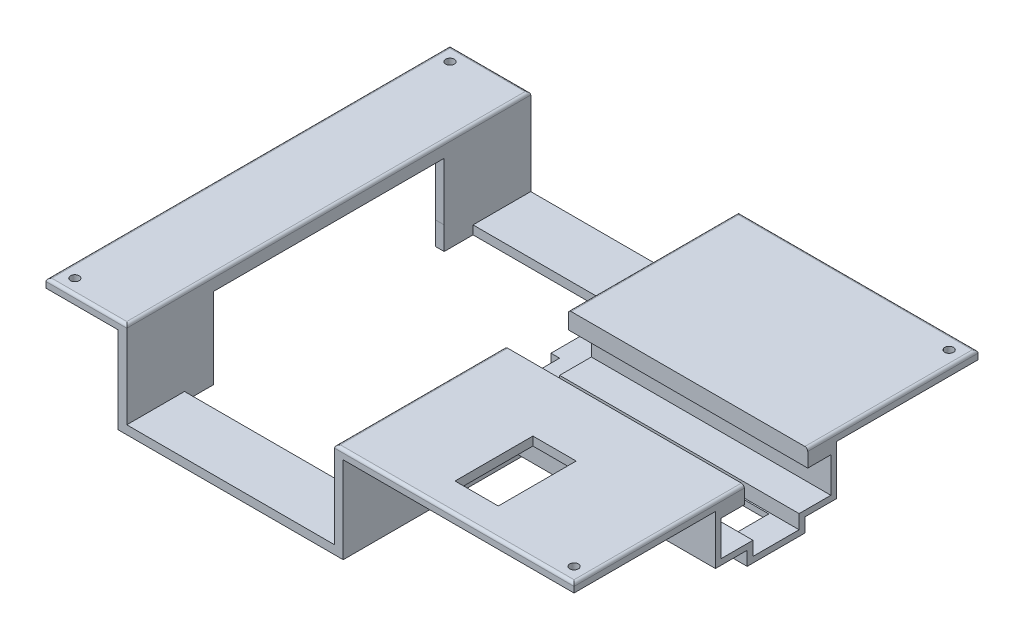
from build123d import *

# Parameters (mm, degrees)
SKETCH1_W               = 183
SKETCH1_H               = 140
BOSS_EXTRUDE1_DEPTH     = 3
SKETCH2_W               = 78
SKETCH2_H               = 140
BOSS_EXTRUDE2_DEPTH     = 30
SKETCH3_W               = 72
SKETCH3_H               = 30
CUT_EXTRUDE1_DEPTH      = 140
SKETCH5_W               = 80
SKETCH5_H               = 70
BOSS_EXTRUDE3_DEPTH     = 25
CUT_EXTRUDE2_DEPTH      = 199.214530244
CUT_EXTRUDE2_DEPTH_BACK = 85
SKETCH7_W               = 20
SKETCH7_H               = 30
CUT_EXTRUDE3_DEPTH      = 85
SKETCH8_W               = 60
SKETCH8_H               = 20
CUT_EXTRUDE4_DEPTH      = 85
SKETCH9_W               = 50
SKETCH9_H               = 15
CUT_EXTRUDE5_DEPTH      = 10
SKETCH11_W              = 20
SKETCH11_H              = 20
CUT_EXTRUDE6_DEPTH      = 10
SKETCH12_W              = 20
SKETCH12_H              = 20
CUT_EXTRUDE7_DEPTH      = 10
SKETCH15_W              = 42
SKETCH15_H              = 100
CUT_EXTRUDE8_DEPTH      = 10
SKETCH16_W              = 13.088467217
SKETCH16_H              = 23
BOSS_EXTRUDE4_DEPTH     = 83
SKETCH17_W              = 13.301151585
SKETCH17_H              = 23.738473688
BOSS_EXTRUDE5_DEPTH     = 83
SKETCH18_W              = 83
SKETCH18_H              = 6
BOSS_EXTRUDE6_DEPTH     = 8
SKETCH19_W              = 83
SKETCH19_H              = 6
BOSS_EXTRUDE7_DEPTH     = 8
SKETCH20_W              = 14
SKETCH20_H              = 25
CUT_EXTRUDE9_DEPTH      = 80
SKETCH21_W              = 14
SKETCH21_H              = 25
CUT_EXTRUDE10_DEPTH     = 80
SKETCH22_W              = 42
SKETCH22_H              = 3
CUT_EXTRUDE11_DEPTH     = 80
SKETCH23_W              = 10
SKETCH23_H              = 100
CUT_EXTRUDE12_DEPTH     = 3
SKETCH24_W              = 80.000727439
SKETCH24_H              = 8
CUT_EXTRUDE13_DEPTH     = 3
SKETCH25_W              = 11
SKETCH25_H              = 4.85
BOSS_EXTRUDE9_DEPTH     = 83
SKETCH26_W              = 11
SKETCH26_H              = 4.85
BOSS_EXTRUDE10_DEPTH    = 83
SKETCH27_W              = 11
SKETCH27_H              = 4.85
CUT_EXTRUDE14_DEPTH     = 80
SKETCH28_W              = 11
SKETCH28_H              = 4.85
CUT_EXTRUDE15_DEPTH     = 80
SKETCH29_W              = 15
SKETCH29_H              = 27
CUT_EXTRUDE16_DEPTH     = 12
FILLET2_R               = 1
SKETCH30_R              = 1.5
CUT_EXTRUDE17_DEPTH     = 3
SKETCH31_R              = 1.5
CUT_EXTRUDE18_DEPTH     = 3
SKETCH32_R              = 1.5
CUT_EXTRUDE19_DEPTH     = 3
SKETCH33_R              = 1.5
CUT_EXTRUDE20_DEPTH     = 3


with BuildPart() as part:
    # Sketch1 → Boss-Extrude1 (new body)
    with BuildSketch(Plane(origin=(0, 0, 0), x_dir=(1, 0, 0), z_dir=(0, 1, 0))):
        Rectangle(SKETCH1_W, SKETCH1_H)
    extrude(amount=BOSS_EXTRUDE1_DEPTH)

    # Sketch2 → Boss-Extrude2 (add)
    with BuildSketch(Plane.XZ):
        with Locations((-27.5, 0)):
            Rectangle(SKETCH2_W, SKETCH2_H)
    extrude(amount=BOSS_EXTRUDE2_DEPTH)

    # Sketch3 → Cut-Extrude1 (cut)
    with BuildSketch(Plane.XY.offset(70)):
        with Locations((-27.5, -12)):
            Rectangle(SKETCH3_W, SKETCH3_H)
    extrude(amount=-CUT_EXTRUDE1_DEPTH, mode=Mode.SUBTRACT)

    # Sketch5 → Boss-Extrude3 (add)
    with BuildSketch(Plane.XZ):
        with Locations((51.5, 0)):
            Rectangle(SKETCH5_W, SKETCH5_H)
    extrude(amount=BOSS_EXTRUDE3_DEPTH)

    # Sketch6 → Cut-Extrude2 (cut, two sides: drawn at the far end of the back side and taken through both)
    with BuildSketch(Plane(origin=(91.5, 0, 0), x_dir=(0, 0, -1), z_dir=(1, 0, 0)).offset(-CUT_EXTRUDE2_DEPTH_BACK)):
        Polygon((-20, 204.718543704), (-20, 3), (-20, -4.67262363), (-30, -4.67262363), (-30, -20), (30, -20), (30, -4.67262363), (20, -4.67262363), (20, 3), (20, 204.718543704), (20, 608.155631112), (-20, 608.155631112), align=None)
    extrude(amount=CUT_EXTRUDE2_DEPTH + CUT_EXTRUDE2_DEPTH_BACK, mode=Mode.SUBTRACT)

    # Sketch7 → Cut-Extrude3 (cut)
    with BuildSketch(Plane(origin=(0, -27, 0), x_dir=(1, 0, 0), z_dir=(0, 1, 0))):
        with Locations((-18.5, 10)):
            Rectangle(SKETCH7_W, SKETCH7_H)
    extrude(amount=-CUT_EXTRUDE3_DEPTH, mode=Mode.SUBTRACT)

    # Sketch8 → Cut-Extrude4 (cut)
    with BuildSketch(Plane(origin=(-63.5, 0, 0), x_dir=(0, 0, -1), z_dir=(1, 0, 0))):
        with Locations((10, -12)):
            Rectangle(SKETCH8_W, SKETCH8_H)
    extrude(amount=-CUT_EXTRUDE4_DEPTH, mode=Mode.SUBTRACT)

    # Sketch9 → Cut-Extrude5 (cut)
    with BuildSketch(Plane.XZ.offset(25)):
        with Locations((56.5, 0)):
            Rectangle(SKETCH9_W, SKETCH9_H)
    extrude(amount=-CUT_EXTRUDE5_DEPTH, mode=Mode.SUBTRACT)

    # Sketch11 → Cut-Extrude6 (cut)
    with BuildSketch(Plane(origin=(-63.5, 0, 0), x_dir=(0, 0, -1), z_dir=(1, 0, 0))):
        with Locations((-30, -12)):
            Rectangle(SKETCH11_W, SKETCH11_H)
    extrude(amount=-CUT_EXTRUDE6_DEPTH, mode=Mode.SUBTRACT)

    # Sketch12 → Cut-Extrude7 (cut)
    with BuildSketch(Plane(origin=(0, -27, 0), x_dir=(1, 0, 0), z_dir=(0, 1, 0))):
        with Locations((-18.5, -15)):
            Rectangle(SKETCH12_W, SKETCH12_H)
    extrude(amount=-CUT_EXTRUDE7_DEPTH, mode=Mode.SUBTRACT)

    # Sketch15 → Cut-Extrude8 (cut)
    with BuildSketch(Plane(origin=(0, -27, 0), x_dir=(1, 0, 0), z_dir=(0, 1, 0))):
        with Locations((-32.5, 0)):
            Rectangle(SKETCH15_W, SKETCH15_H)
    extrude(amount=-CUT_EXTRUDE8_DEPTH, mode=Mode.SUBTRACT)

    # Sketch16 → Boss-Extrude4 (add)
    with BuildSketch(Plane(origin=(91.5, 0, 0), x_dir=(0, 0, -1), z_dir=(1, 0, 0))):
        with Locations((-25.544233609, -8.5)):
            Rectangle(SKETCH16_W, SKETCH16_H)
    extrude(amount=-BOSS_EXTRUDE4_DEPTH)

    # Sketch17 → Boss-Extrude5 (add)
    with BuildSketch(Plane(origin=(91.5, 0, 0), x_dir=(0, 0, -1), z_dir=(1, 0, 0))):
        with Locations((25.650575792, -8.869236844)):
            Rectangle(SKETCH17_W, SKETCH17_H)
    extrude(amount=-BOSS_EXTRUDE5_DEPTH)

    # Sketch18 → Boss-Extrude6 (add)
    with BuildSketch(Plane(origin=(0, 0, 19), x_dir=(-1, 0, 0), z_dir=(0, 0, -1))):
        with Locations((-50, 0)):
            Rectangle(SKETCH18_W, SKETCH18_H)
    extrude(amount=BOSS_EXTRUDE6_DEPTH)

    # Sketch19 → Boss-Extrude7 (add)
    with BuildSketch(Plane.XY.offset(-19)):
        with Locations((50, 0)):
            Rectangle(SKETCH19_W, SKETCH19_H)
    extrude(amount=BOSS_EXTRUDE7_DEPTH)

    # Sketch20 → Cut-Extrude9 (cut)
    with BuildSketch(Plane(origin=(91.5, 0, 0), x_dir=(0, 0, -1), z_dir=(1, 0, 0))):
        with Locations((-28, -12.5)):
            Rectangle(SKETCH20_W, SKETCH20_H)
    extrude(amount=-CUT_EXTRUDE9_DEPTH, mode=Mode.SUBTRACT)

    # Sketch21 → Cut-Extrude10 (cut)
    with BuildSketch(Plane(origin=(91.5, 0, 0), x_dir=(0, 0, -1), z_dir=(1, 0, 0))):
        with Locations((28, -12.5)):
            Rectangle(SKETCH21_W, SKETCH21_H)
    extrude(amount=-CUT_EXTRUDE10_DEPTH, mode=Mode.SUBTRACT)

    # Sketch22 → Cut-Extrude11 (cut)
    with BuildSketch(Plane(origin=(91.5, 0, 0), x_dir=(0, 0, -1), z_dir=(1, 0, 0))):
        with Locations((0, -23.5)):
            Rectangle(SKETCH22_W, SKETCH22_H)
    extrude(amount=-CUT_EXTRUDE11_DEPTH, mode=Mode.SUBTRACT)

    # Sketch23 → Cut-Extrude12 (cut)
    with BuildSketch(Plane(origin=(0, -27, 0), x_dir=(1, 0, 0), z_dir=(0, 1, 0))):
        with Locations((-58.5, 0)):
            Rectangle(SKETCH23_W, SKETCH23_H)
    extrude(amount=-CUT_EXTRUDE12_DEPTH, mode=Mode.SUBTRACT)

    # Sketch24 → Cut-Extrude13 (cut)
    with BuildSketch(Plane(origin=(-63.5, 0, 0), x_dir=(0, 0, -1), z_dir=(1, 0, 0))):
        with Locations((0.00036372, -26)):
            Rectangle(SKETCH24_W, SKETCH24_H)
    extrude(amount=-CUT_EXTRUDE13_DEPTH, mode=Mode.SUBTRACT)

    # Sketch25 → Boss-Extrude9 (add)
    with BuildSketch(Plane(origin=(91.5, 0, 0), x_dir=(0, 0, -1), z_dir=(1, 0, 0))):
        with Locations((-13.5, -17.575)):
            Rectangle(SKETCH25_W, SKETCH25_H)
    extrude(amount=-BOSS_EXTRUDE9_DEPTH)

    # Sketch26 → Boss-Extrude10 (add)
    with BuildSketch(Plane(origin=(91.5, 0, 0), x_dir=(0, 0, -1), z_dir=(1, 0, 0))):
        with Locations((13.5, -17.575)):
            Rectangle(SKETCH26_W, SKETCH26_H)
    extrude(amount=-BOSS_EXTRUDE10_DEPTH)

    # Sketch27 → Cut-Extrude14 (cut)
    with BuildSketch(Plane(origin=(91.5, 0, 0), x_dir=(0, 0, -1), z_dir=(1, 0, 0))):
        with Locations((-15.5, -19.575)):
            Rectangle(SKETCH27_W, SKETCH27_H)
    extrude(amount=-CUT_EXTRUDE14_DEPTH, mode=Mode.SUBTRACT)

    # Sketch28 → Cut-Extrude15 (cut)
    with BuildSketch(Plane(origin=(91.5, 0, 0), x_dir=(0, 0, -1), z_dir=(1, 0, 0))):
        with Locations((15.5, -19.575)):
            Rectangle(SKETCH28_W, SKETCH28_H)
    extrude(amount=-CUT_EXTRUDE15_DEPTH, mode=Mode.SUBTRACT)

    # Sketch29 → Cut-Extrude16 (cut)
    with BuildSketch(Plane(origin=(0, 3, 0), x_dir=(1, 0, 0), z_dir=(0, 1, 0))):
        with Locations((47.741795072, -46.5)):
            Rectangle(SKETCH29_W, SKETCH29_H)
    extrude(amount=-CUT_EXTRUDE16_DEPTH, mode=Mode.SUBTRACT)

    # Fillet2
    fillet2_edges = [part.edges().sort_by_distance(p)[0] for p in [
        (91.5, 3, 40.5),
        (50, 3, -70),
        (50, 3, 70),
        (-77.5, 3, -70),
        (-63.5, 3, 0),
        (8.5, 3, -40.5),
        (-91.5, 3, 0),
        (8.5, 3, 40.5),
        (91.5, 3, -40.5),
        (-77.5, 3, 70),
    ]]
    fillet(fillet2_edges, radius=FILLET2_R)

    # Sketch30 → Cut-Extrude17 (cut)
    with BuildSketch(Plane(origin=(0, 3, 0), x_dir=(1, 0, 0), z_dir=(0, 1, 0))):
        with Locations(Location((-86.5, -65, 0), (0, 0, 270))):
            Circle(SKETCH30_R)
    extrude(amount=-CUT_EXTRUDE17_DEPTH, mode=Mode.SUBTRACT)

    # Sketch31 → Cut-Extrude18 (cut)
    with BuildSketch(Plane(origin=(0, 3, 0), x_dir=(1, 0, 0), z_dir=(0, 1, 0))):
        with Locations(Location((-86.5, 65, 0), (0, 0, 270))):
            Circle(SKETCH31_R)
    extrude(amount=-CUT_EXTRUDE18_DEPTH, mode=Mode.SUBTRACT)

    # Sketch32 → Cut-Extrude19 (cut)
    with BuildSketch(Plane(origin=(0, 3, 0), x_dir=(1, 0, 0), z_dir=(0, 1, 0))):
        with Locations(Location((86.5, 65, 0), (0, 0, 270))):
            Circle(SKETCH32_R)
    extrude(amount=-CUT_EXTRUDE19_DEPTH, mode=Mode.SUBTRACT)

    # Sketch33 → Cut-Extrude20 (cut)
    with BuildSketch(Plane(origin=(0, 3, 0), x_dir=(1, 0, 0), z_dir=(0, 1, 0))):
        with Locations(Location((86.5, -65, 0), (0, 0, 270))):
            Circle(SKETCH33_R)
    extrude(amount=-CUT_EXTRUDE20_DEPTH, mode=Mode.SUBTRACT)


solid = part.part
